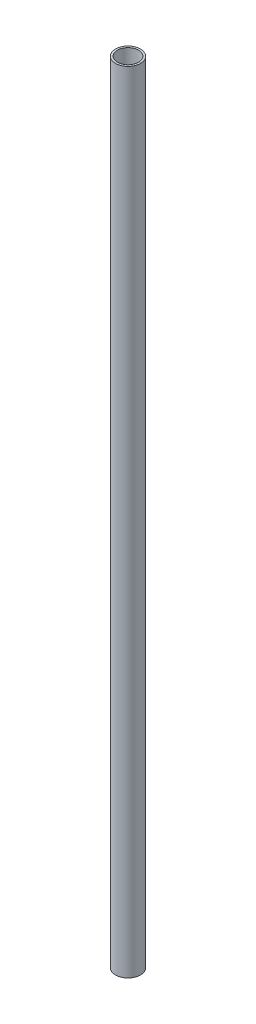
from build123d import *

# Parameters (mm, degrees)
SKETCH1_R           = 7.9375
SKETCH1_R_2         = 6.6929
BOSS_EXTRUDE1_DEPTH = 501.65


with BuildPart() as part:
    # Sketch1 → Boss-Extrude1 (new body)
    with BuildSketch(Plane(origin=(0, 0, 0), x_dir=(1, 0, 0), z_dir=(0, 1, 0))):
        with Locations(Location((0, 0, 0), (0, 0, 270))):
            Circle(SKETCH1_R)
        with Locations(Location((0, 0, 0), (0, 0, 270))):
            Circle(SKETCH1_R_2, mode=Mode.SUBTRACT)
    extrude(amount=BOSS_EXTRUDE1_DEPTH)


solid = part.part
